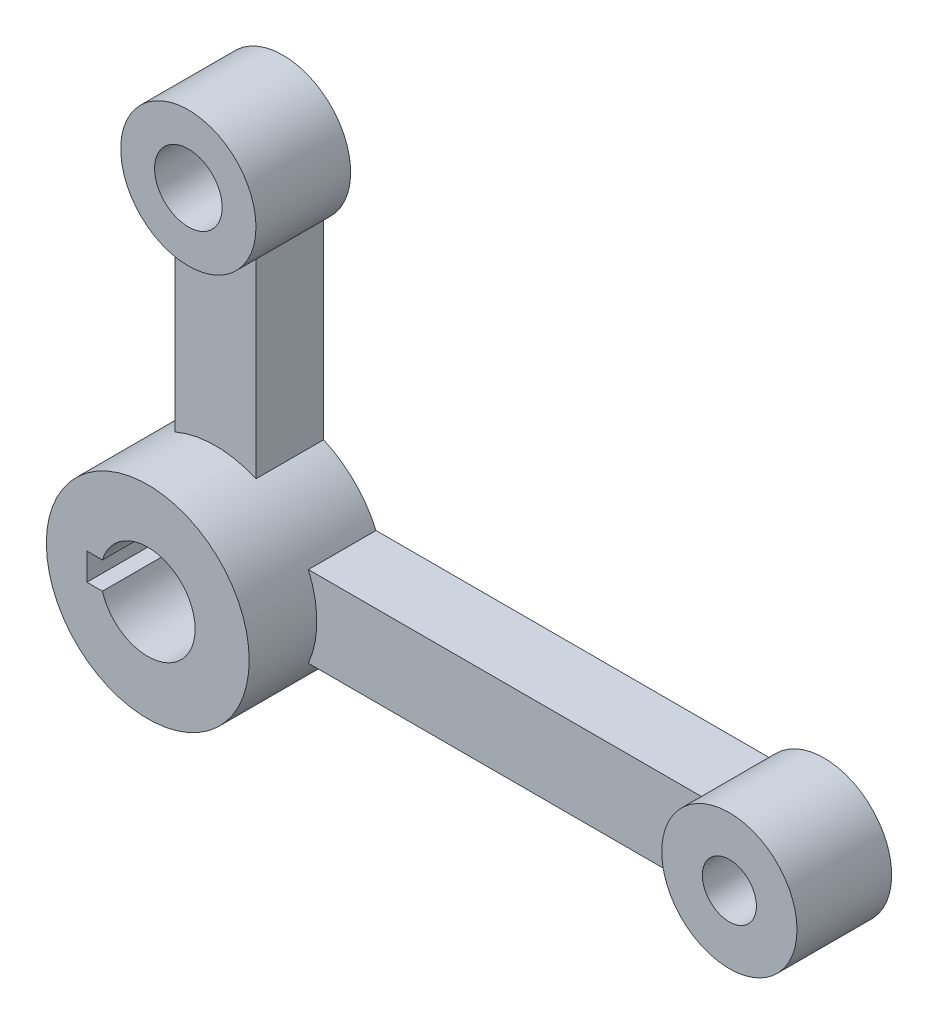
from build123d import *

# Parameters (mm, degrees)
SKETCH_1_R          = 15
EXTRUDE_1_DEPTH     = 20
SKETCH_10_R         = 10
EXTRUDE_10_DEPTH    = 14
SKETCH_11_R         = 10
EXTRUDE_11_DEPTH    = 14
SKETCH_12_W         = 12
SKETCH_12_H         = 50
EXTRUDE_12_DEPTH    = 10
SKETCH_13_W         = 80
SKETCH_13_H         = 12
EXTRUDE_13_DEPTH    = 10
SKETCH_14_R         = 5
CUT_EXTRUDE_1_DEPTH = 111
SKETCH_15_R         = 4
CUT_EXTRUDE_2_DEPTH = 111
SKETCH_16_R         = 7
CUT_EXTRUDE_3_DEPTH = 111
SKETCH_17_W         = 3
SKETCH_17_H         = 4
CUT_EXTRUDE_4_DEPTH = 111


with BuildPart() as part:
    # 草图1 → 凸台-拉伸1 (new body)
    with BuildSketch(Plane.XY.offset(-10)):
        Circle(SKETCH_1_R)
    extrude(amount=EXTRUDE_1_DEPTH)



with BuildPart() as body_2:
    # 草图10 → 凸台-拉伸10 (new body)
    with BuildSketch(Plane.XY.offset(-10)):
        with Locations((0, 50)):
            Circle(SKETCH_10_R)
    extrude(amount=EXTRUDE_10_DEPTH)


with BuildPart() as body_3:
    # 草图11 → 凸台-拉伸11 (new body)
    with BuildSketch(Plane.XY.offset(-10)):
        with Locations((80, 0)):
            Circle(SKETCH_11_R)
    extrude(amount=EXTRUDE_11_DEPTH)


with BuildPart() as part_1:
    add(part.part)

    add(body_2.part)  # 凸台-拉伸12 merges body 2
    # 草图12 → 凸台-拉伸12 (add)
    with BuildSketch(Plane.XY.offset(-10)):
        with Locations((0, 25)):
            Rectangle(SKETCH_12_W, SKETCH_12_H)
    extrude(amount=EXTRUDE_12_DEPTH)


    add(body_3.part)  # 凸台-拉伸13 merges body 3
    # 草图13 → 凸台-拉伸13 (add)
    with BuildSketch(Plane.XY.offset(-10)):
        with Locations((40, 0)):
            Rectangle(SKETCH_13_W, SKETCH_13_H)
    extrude(amount=EXTRUDE_13_DEPTH)

    # 草图14 → 切除-拉伸1 (cut, through all)
    with BuildSketch(Plane.XY.offset(-10)):
        with Locations((0, 50)):
            Circle(SKETCH_14_R)
    extrude(amount=CUT_EXTRUDE_1_DEPTH, mode=Mode.SUBTRACT)

    # 草图15 → 切除-拉伸2 (cut, through all)
    with BuildSketch(Plane.XY.offset(-10)):
        with Locations((80, 0)):
            Circle(SKETCH_15_R)
    extrude(amount=CUT_EXTRUDE_2_DEPTH, mode=Mode.SUBTRACT)

    # 草图16 → 切除-拉伸3 (cut, through all)
    with BuildSketch(Plane.XY.offset(-10)):
        Circle(SKETCH_16_R)
    extrude(amount=CUT_EXTRUDE_3_DEPTH, mode=Mode.SUBTRACT)

    # 草图17 → 切除-拉伸4 (cut, through all)
    with BuildSketch(Plane.XY.offset(-10)):
        with Locations((-7.5, 0)):
            Rectangle(SKETCH_17_W, SKETCH_17_H)
    extrude(amount=CUT_EXTRUDE_4_DEPTH, mode=Mode.SUBTRACT)


solid = part_1.part
